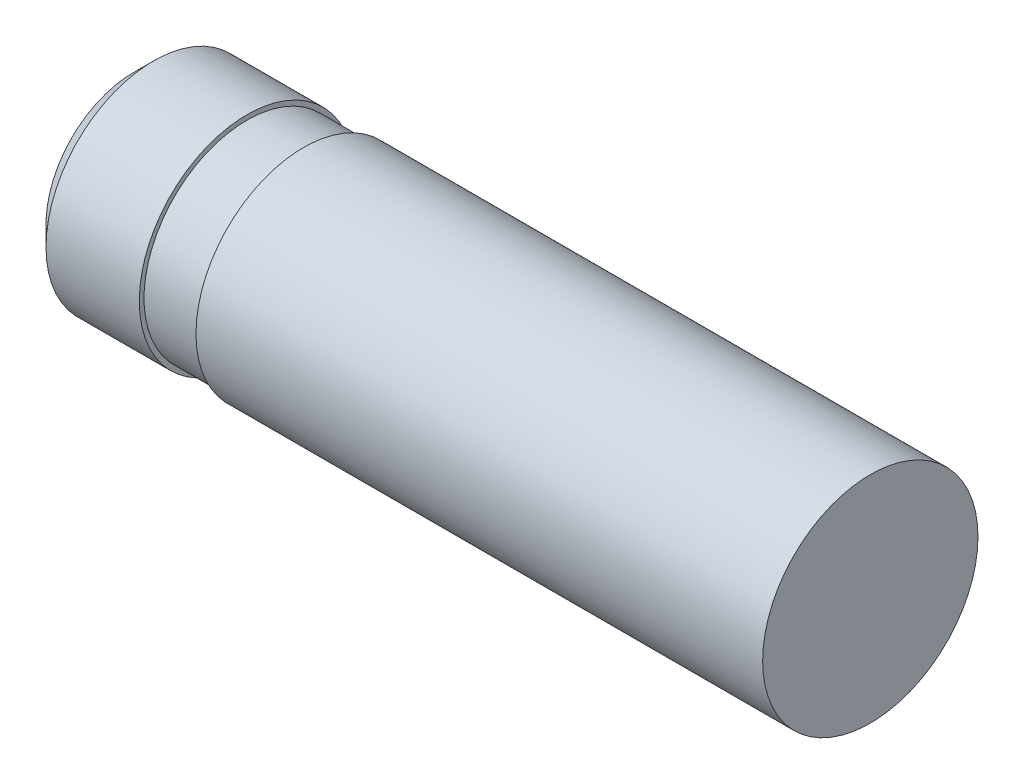
from build123d import *


with BuildPart() as part:
    # Sketch1 → Revolve1 (revolve)
    with BuildSketch(Plane.XY, mode=Mode.PRIVATE) as revolve1_sk:
        Polygon((0, 0), (0, 1.546446609), (0.353553391, 1.9), (2, 1.9), (2, 1.816621755), (3, 1.816621755), (3, 1.9), (13, 1.9), (13, 0), align=None)
    revolve(revolve1_sk.sketch.rotate(Axis((13, 0, 0), (-1, 0, 0)), 90), axis=Axis((13, 0, 0), (-1, 0, 0)))


solid = part.part
